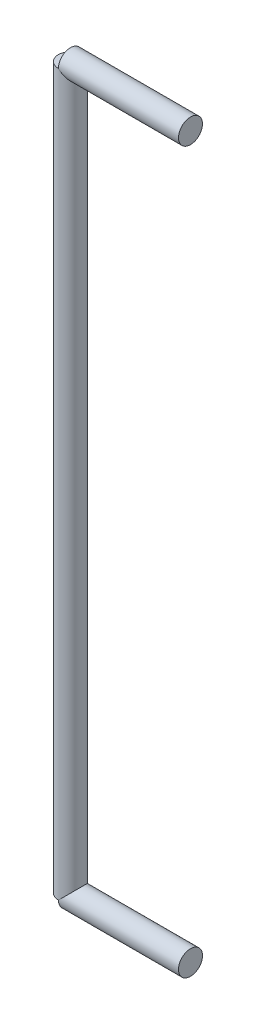
from build123d import *

# Parameters (mm, degrees)
SKETCH1_R           = 0.5
BOSS_EXTRUDE2_DEPTH = 30
SKETCH9_R           = 0.5
BOSS_EXTRUDE3_DEPTH = 5


with BuildPart() as part:
    # Sketch1 → Boss-Extrude2 (new body)
    with BuildSketch(Plane(origin=(0, 0, 0), x_dir=(1, 0, 0), z_dir=(0, 1, 0))):
        with Locations(Location((0, 0, 0), (0, 0, 270))):
            Circle(SKETCH1_R)
    extrude(amount=BOSS_EXTRUDE2_DEPTH)

    # Sketch9 → Boss-Extrude3 (add)
    with BuildSketch(Plane(origin=(0, 0, 0), x_dir=(0, 0, -1), z_dir=(1, 0, 0))):
        Circle(SKETCH9_R)
        with Locations((0, 30)):
            Circle(SKETCH9_R)
    extrude(amount=BOSS_EXTRUDE3_DEPTH)


solid = part.part
